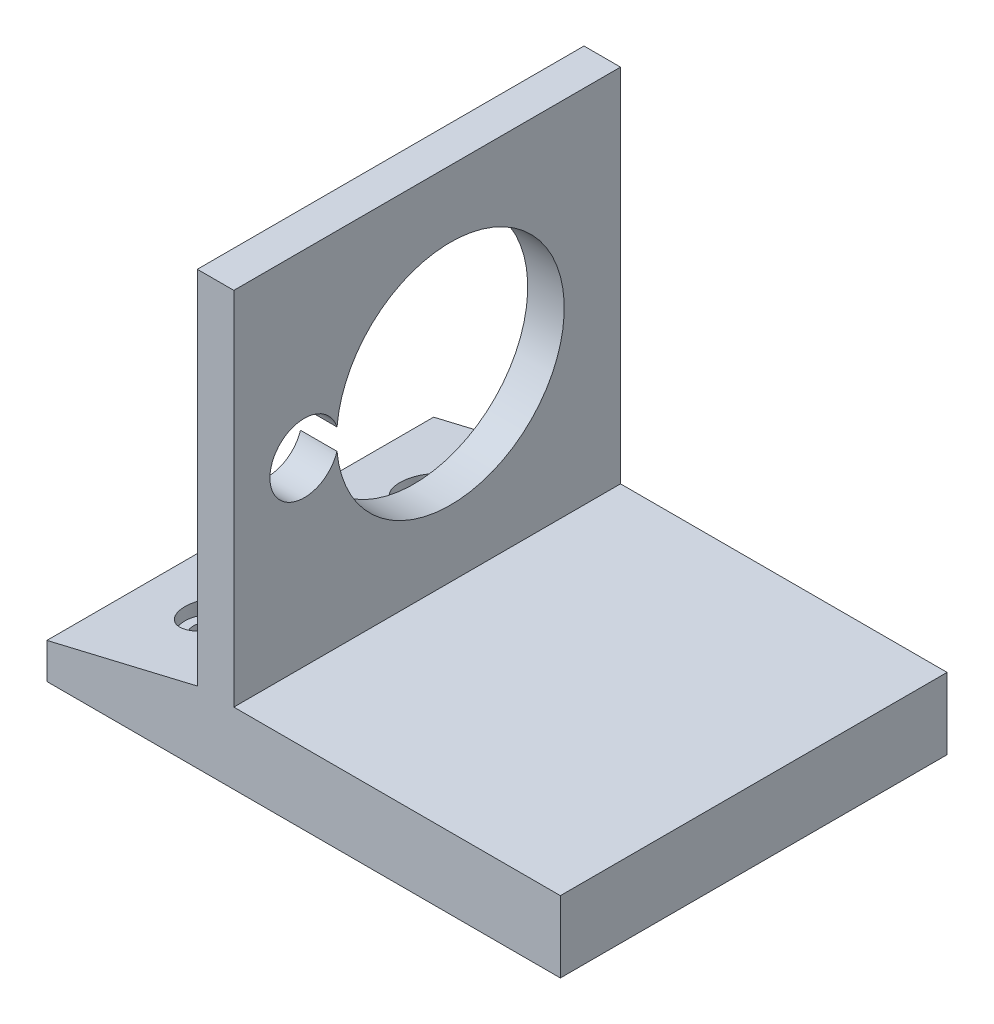
from build123d import *

# Parameters (mm, degrees)
BOSS_EXTRU_1_DEPTH      = 45
ENL_V_MAT_EXTRU_1_DEPTH = 609.201213002
ESQUISSE3_R             = 2
ENL_V_MAT_EXTRU_2_DEPTH = 91.138958208
ESQUISSE4_R             = 3
ENL_V_MAT_EXTRU_3_DEPTH = 46.15


with BuildPart() as part:
    # Esquisse1 → Boss.-Extru.1 (new body)
    with BuildSketch(Plane.XY):
        Polygon((-38, -554.760879723), (-38, -596.760879723), (0, -596.760879723), (0, -605.060879723), (-59.74898984, -605.060879723), (-59.74898984, -600.910879723), (-42.249820419, -596.760879723), (-42.249820419, -554.760879723), align=None)
    extrude(amount=-BOSS_EXTRU_1_DEPTH)

    # Esquisse2 → Enlèv. mat.-Extru.1 (cut, through all)
    with BuildSketch(Plane.ZY.offset(42.249820419)):
        with BuildLine():
            ThreePointArc((-12.006985294, -576.988423193), (-4.2, -575.760879723), (-12.006985294, -574.533336253))
            ThreePointArc((-12.006985294, -574.533336253), (-38.45, -575.760879723), (-12.006985294, -576.988423193))
        make_face()
    extrude(amount=-ENL_V_MAT_EXTRU_1_DEPTH, mode=Mode.SUBTRACT)

    # Esquisse3 → Enlèv. mat.-Extru.2 (cut, through all)
    with BuildSketch(Plane.XZ.offset(605.060879723)):
        with Locations(Location((-50.683510071, -35, 0), (0, 0, 270))):
            Circle(ESQUISSE3_R)
        with Locations(Location((-50.683510071, -10, 0), (0, 0, 270))):
            Circle(ESQUISSE3_R)
    extrude(amount=-ENL_V_MAT_EXTRU_2_DEPTH, mode=Mode.SUBTRACT)

    # Esquisse4 → Enlèv. mat.-Extru.3 (cut)
    with BuildSketch(Plane(origin=(0, -554.760879723, 0), x_dir=(1, 0, 0), z_dir=(0, 1, 0))):
        with Locations(Location((-50.683510071, 10, 0), (0, 0, 270))):
            Circle(ESQUISSE4_R)
        with Locations(Location((-50.683510071, 35, 0), (0, 0, 270))):
            Circle(ESQUISSE4_R)
    extrude(amount=-ENL_V_MAT_EXTRU_3_DEPTH, mode=Mode.SUBTRACT)


solid = part.part
